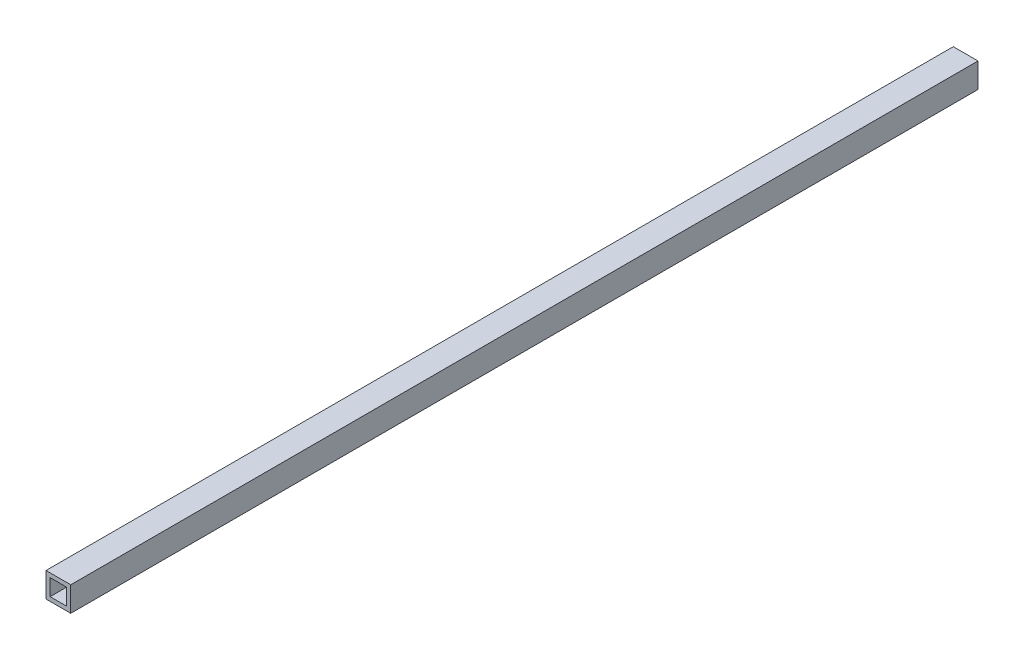
from build123d import *

# Parameters (mm, degrees)
SKETCH1_W           = 19.05
SKETCH1_H           = 19.05
SKETCH1_W_2         = 12.7
SKETCH1_H_2         = 12.7
BOSS_EXTRUDE1_DEPTH = 698.5


with BuildPart() as part:
    # Sketch1 → Boss-Extrude1 (new body)
    with BuildSketch(Plane.XY):
        Rectangle(SKETCH1_W, SKETCH1_H)
        Rectangle(SKETCH1_W_2, SKETCH1_H_2, mode=Mode.SUBTRACT)
    extrude(amount=BOSS_EXTRUDE1_DEPTH)


solid = part.part
